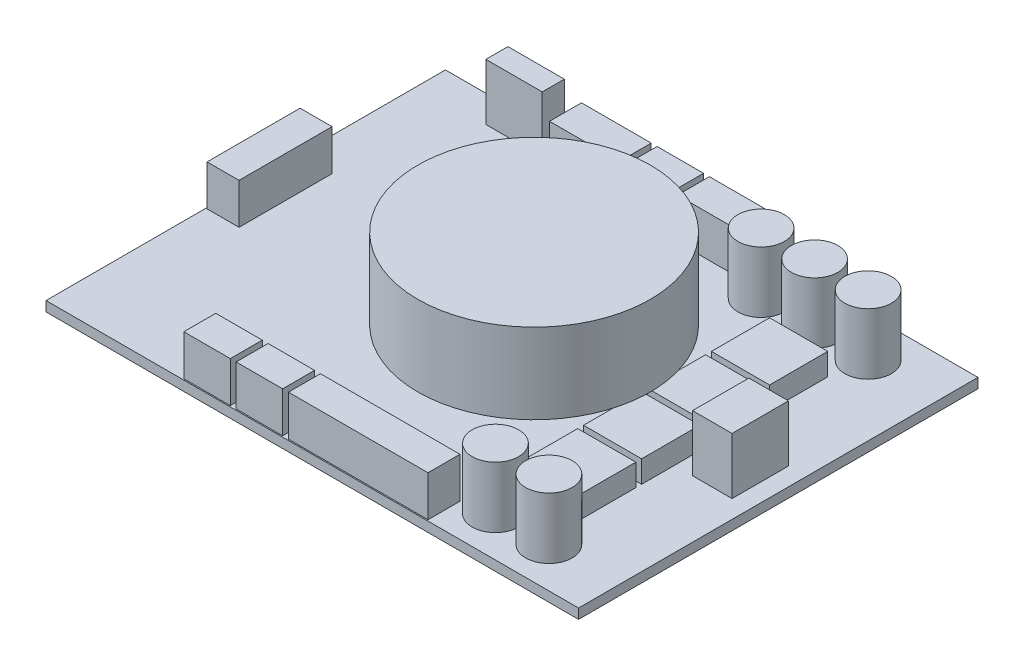
from build123d import *

# Parameters (mm, degrees)
SKETCH1_W           = 91.6
SKETCH1_H           = 68.7
BOSS_EXTRUDE1_DEPTH = 1.7
BOSS_EXTRUDE2_START = 4
SKETCH2_R           = 20
BOSS_EXTRUDE2_DEPTH = 13.8
SKETCH3_R           = 4
BOSS_EXTRUDE3_DEPTH = 10.5
SKETCH4_W           = 10
SKETCH4_H           = 10
BOSS_EXTRUDE4_DEPTH = 3.8
SKETCH6_R           = 10
BOSS_EXTRUDE5_DEPTH = 17.8
SKETCH7_W           = 6.8
SKETCH7_H           = 9.7
SKETCH7_W_2         = 9.7
SKETCH7_H_2         = 3.8
BOSS_EXTRUDE6_DEPTH = 9.7
SKETCH8_W           = 24
SKETCH8_H           = 5.5
SKETCH8_W_2         = 8
SKETCH8_W_3         = 5.5
SKETCH8_H_2         = 16
SKETCH8_W_4         = 12
SKETCH8_W_5         = 10
BOSS_EXTRUDE7_DEPTH = 7


with BuildPart() as part:
    # Sketch1 → Boss-Extrude1 (new body)
    with BuildSketch(Plane(origin=(0, 0, 0), x_dir=(1, 0, 0), z_dir=(0, 1, 0))):
        Rectangle(SKETCH1_W, SKETCH1_H)
    extrude(amount=BOSS_EXTRUDE1_DEPTH)

    # Sketch3 → Boss-Extrude3 (add)
    with BuildSketch(Plane(origin=(0, 1.7, 0), x_dir=(1, 0, 0), z_dir=(0, 1, 0))):
        with Locations(Location((15.4, 27.45, 0), (0, 0, 90))):
            Circle(SKETCH3_R)
        with Locations(Location((24.6, 27.45, 0), (0, 0, 90))):
            Circle(SKETCH3_R)
        with Locations(Location((33.8, 27.45, 0), (0, 0, 90))):
            Circle(SKETCH3_R)
        with Locations(Location((33.8, -27.45, 0), (0, 0, 90))):
            Circle(SKETCH3_R)
        with Locations(Location((24.6, -27.45, 0), (0, 0, 90))):
            Circle(SKETCH3_R)
    extrude(amount=BOSS_EXTRUDE3_DEPTH)

    # Sketch4 → Boss-Extrude4 (add)
    with BuildSketch(Plane(origin=(0, 1.7, 0), x_dir=(1, 0, 0), z_dir=(0, 1, 0))):
        with Locations((27.8, 5.5)):
            Rectangle(SKETCH4_W, SKETCH4_H)
        with Locations((27.8, 16.5)):
            Rectangle(SKETCH4_W, SKETCH4_H)
        with Locations((27.8, -5.5)):
            Rectangle(SKETCH4_W, SKETCH4_H)
        with Locations((27.8, -16.5)):
            Rectangle(SKETCH4_W, SKETCH4_H)
    extrude(amount=BOSS_EXTRUDE4_DEPTH)



with BuildPart() as body_2:
    # Sketch2 → Boss-Extrude2 (new body)
    with BuildSketch(Plane(origin=(0, 1.7, 0), x_dir=(1, 0, 0), z_dir=(0, 1, 0)).offset(BOSS_EXTRUDE2_START)):
        with Locations(Location((3.8, 0, 0), (0, 0, 270))):
            Circle(SKETCH2_R)
    extrude(amount=BOSS_EXTRUDE2_DEPTH)


with BuildPart() as part_1:
    add(part.part)

    add(body_2.part)  # Boss-Extrude5 merges body 2
    # Sketch6 → Boss-Extrude5 (add)
    with BuildSketch(Plane(origin=(0, 19.5, 0), x_dir=(1, 0, 0), z_dir=(0, 1, 0))):
        with Locations(Location((3.8, 0, 0), (0, 0, 270))):
            Circle(SKETCH6_R)
    extrude(amount=-BOSS_EXTRUDE5_DEPTH)

    # Sketch7 → Boss-Extrude6 (add)
    with BuildSketch(Plane(origin=(0, 1.7, 0), x_dir=(1, 0, 0), z_dir=(0, 1, 0))):
        with Locations((39.3, 0)):
            Rectangle(SKETCH7_W, SKETCH7_H)
        with Locations((-29.35, 31.6)):
            Rectangle(SKETCH7_W_2, SKETCH7_H_2)
    extrude(amount=BOSS_EXTRUDE6_DEPTH)

    # Sketch8 → Boss-Extrude7 (add)
    with BuildSketch(Plane(origin=(0, 1.7, 0), x_dir=(1, 0, 0), z_dir=(0, 1, 0))):
        with Locations((7.7, -31.4)):
            Rectangle(SKETCH8_W, SKETCH8_H)
        with Locations((-9.3, -31.4)):
            Rectangle(SKETCH8_W_2, SKETCH8_H)
        with Locations((-18.3, -31.4)):
            Rectangle(SKETCH8_W_2, SKETCH8_H)
        with Locations((-42.85, 1.15)):
            Rectangle(SKETCH8_W_3, SKETCH8_H_2)
        with Locations((-16.2, 31.4)):
            Rectangle(SKETCH8_W_4, SKETCH8_H)
        with Locations((-5.2, 31.4)):
            Rectangle(SKETCH8_W_2, SKETCH8_H)
        with Locations((4.8, 31.4)):
            Rectangle(SKETCH8_W_5, SKETCH8_H)
    extrude(amount=BOSS_EXTRUDE7_DEPTH)


solid = part_1.part
